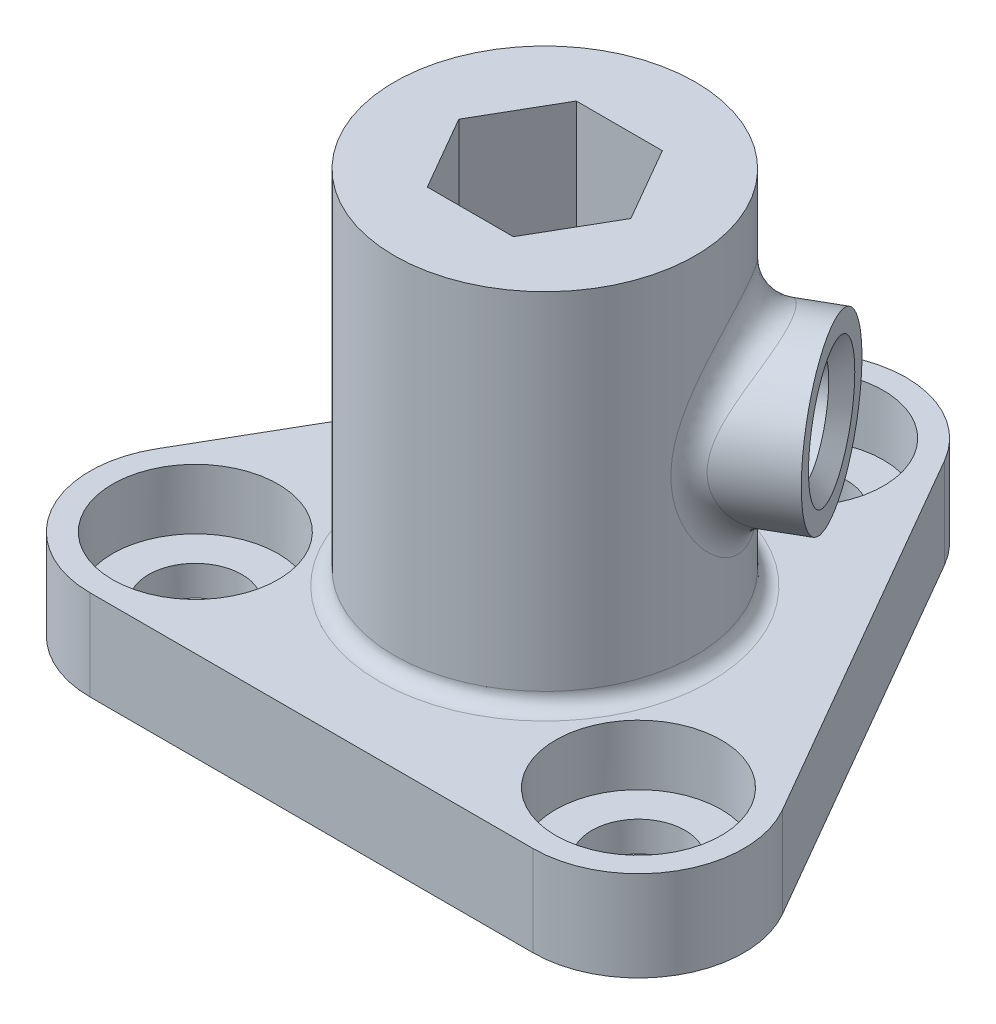
from build123d import *

# Parameters (mm, degrees)
SKETCH4_R                = 2.75
CUT_EXTRUDE4_DEPTH       = 2
SKETCH5_OUTSIDE_W        = 33.422
SKETCH5_OUTSIDE_H        = 33.422
CUT_EXTRUDE5_DEPTH       = 21.784609691
CUT_EXTRUDE2_DEPTH       = 8
BOSS_EXTRUDE1_REACH      = 27.238
BOSS_EXTRUDE1_END_RADIUS = 5
SKETCH3_R                = 2.75
CUT_EXTRUDE6_REACH       = 27.238
SKETCH6_R                = 1.6
FILLET1_R                = 0.5
CHAMFER1_SIZE            = 0.5
FILLET2_R                = 1
SKETCH7_R                = 1.55
CUT_EXTRUDE7_DEPTH       = 21.148598312


with BuildPart() as part:
    # Sketch1 → Revolve1 (revolve)
    with BuildSketch(Plane(origin=(0, 0, 0), x_dir=(0, 0, -1), z_dir=(1, 0, 0))):
        Polygon((0, 0), (12, 0), (12, 3), (5, 3), (5, 15), (0, 15), (0, 5.353547723), align=None)
    revolve(axis=Axis((0, 5.353547723, 0), (0, 1, 0)))

    # Sketch4 → Cut-Extrude4 (cut)
    with BuildSketch(Plane(origin=(0, 3, 0), x_dir=(1, 0, 0), z_dir=(0, 1, 0))):
        with Locations(Location((0, 8.5, 0), (0, 0, 270))):
            Circle(SKETCH4_R)
        with Locations(Location((7.361215932, -4.25, 0), (0, 0, 270))):
            Circle(SKETCH4_R)
        with Locations(Location((-7.361215932, -4.25, 0), (0, 0, 270))):
            Circle(SKETCH4_R)
    extrude(amount=-CUT_EXTRUDE4_DEPTH, mode=Mode.SUBTRACT)

    # Sketch5 outside → Cut-Extrude5 (cut, through all)
    with BuildSketch(Plane(origin=(0, 3, 0), x_dir=(1, 0, 0), z_dir=(0, 1, 0))):
        Rectangle(SKETCH5_OUTSIDE_W, SKETCH5_OUTSIDE_H)
        with BuildLine():
            Line((-3.031088913, 10.25), (-10.392304845, -2.5))
            ThreePointArc((-10.392304845, -2.5), (-10.392304845, -6), (-7.361215932, -7.75))
            Line((-7.361215932, -7.75), (7.361215932, -7.75))
            ThreePointArc((7.361215932, -7.75), (10.392304845, -6), (10.392304845, -2.5))
            Line((10.392304845, -2.5), (3.031088913, 10.25))
            ThreePointArc((3.031088913, 10.25), (0, 12), (-3.031088913, 10.25))
        make_face(mode=Mode.SUBTRACT)
    extrude(amount=-CUT_EXTRUDE5_DEPTH, mode=Mode.SUBTRACT)

    # Sketch2 → Cut-Extrude2 (cut)
    with BuildSketch(Plane(origin=(0, 15, 0), x_dir=(1, 0, 0), z_dir=(0, 1, 0))):
        Polygon((2.857883832, 0), (1.428941916, 2.475), (-1.428941916, 2.475), (-2.857883832, 0), (-1.428941916, -2.475), (1.428941916, -2.475), align=None)
    extrude(amount=-CUT_EXTRUDE2_DEPTH, mode=Mode.SUBTRACT)

    # Boss-Extrude1: up to this cylinder (the profile starts outside it)
    boss_extrude1_end = Plane(origin=(0, 9, 0), z_dir=(0, -1, 0)) * Cylinder(BOSS_EXTRUDE1_END_RADIUS, 65.476, mode=Mode.PRIVATE)
    # Sketch3 → Boss-Extrude1 (add, up to the surface)
    with BuildSketch(Plane(origin=(6.040527191, 0, -3.4875), x_dir=(-0.5000000000000001, 0, -0.8660254037844386), z_dir=(0.8660254037844386, 0, -0.5000000000000001)), mode=Mode.PRIVATE) as boss_extrude1_sk1:
        with Locations((0, 9)):
            Circle(SKETCH3_R)
    boss_extrude1_tool1 = extrude(boss_extrude1_sk1.sketch, amount=-BOSS_EXTRUDE1_REACH, mode=Mode.PRIVATE) - boss_extrude1_end
    add(boss_extrude1_tool1.solids().sort_by_distance((6.040527, 9, -3.4875))[0])

    # Sketch6 → Cut-Extrude6 (cut, up to next)
    with BuildSketch(Plane(origin=(6.040527191, 0, -3.4875), x_dir=(-0.5000000000000001, 0, -0.8660254037844386), z_dir=(0.8660254037844386, 0, -0.5000000000000001)), mode=Mode.PRIVATE) as cut_extrude6_sk1:
        with Locations((0, 9)):
            Circle(SKETCH6_R)
    cut_extrude6_tool1 = extrude(cut_extrude6_sk1.sketch, amount=-CUT_EXTRUDE6_REACH, mode=Mode.PRIVATE) & part.part
    add(cut_extrude6_tool1.solids().sort_by_distance((6.040527, 9, -3.4875))[0], mode=Mode.SUBTRACT)

    # Fillet1
    fillet1_edges = [part.edges().sort_by_distance(p)[0] for p in [
        (0, 3, 5),
    ]]
    fillet(fillet1_edges, radius=FILLET1_R)

    # Chamfer1
    chamfer1_edges = [part.edges().sort_by_distance(p)[0] for p in [
        (6.840527191, 9, -2.101859354),
    ]]
    chamfer(chamfer1_edges, length=CHAMFER1_SIZE)

    # Fillet2
    fillet2_edges = [part.edges().sort_by_distance(p)[0] for p in [
        (4.991369035, 8.999999998, 0.293658225),
    ]]
    fillet(fillet2_edges, radius=FILLET2_R)

    # Sketch7 → Cut-Extrude7 (cut, through all)
    with BuildSketch(Plane(origin=(0, 3, 0), x_dir=(1, 0, 0), z_dir=(0, 1, 0))):
        with Locations(Location((0, 8.5, 0), (0, 0, 270))):
            Circle(SKETCH7_R)
        with Locations(Location((7.361215932, -4.25, 0), (0, 0, 270))):
            Circle(SKETCH7_R)
        with Locations(Location((-7.361215932, -4.25, 0), (0, 0, 270))):
            Circle(SKETCH7_R)
    extrude(amount=-CUT_EXTRUDE7_DEPTH, mode=Mode.SUBTRACT)


solid = part.part
